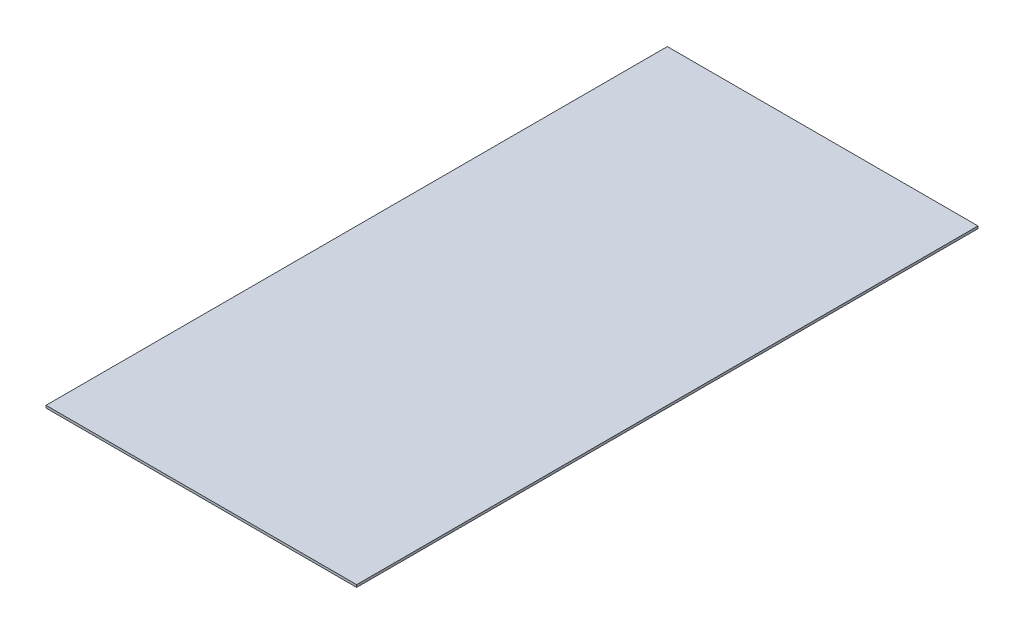
from build123d import *

# Parameters (mm, degrees)
CROQUIS1_W              = 1219.2
CROQUIS1_H              = 2438.4
SALIENTE_EXTRUIR1_DEPTH = 9.5


with BuildPart() as part:
    # Croquis1 → Saliente-Extruir1 (new body)
    with BuildSketch(Plane(origin=(0, 0, 0), x_dir=(1, 0, 0), z_dir=(0, 1, 0))):
        Rectangle(CROQUIS1_W, CROQUIS1_H)
    extrude(amount=SALIENTE_EXTRUIR1_DEPTH)


solid = part.part
